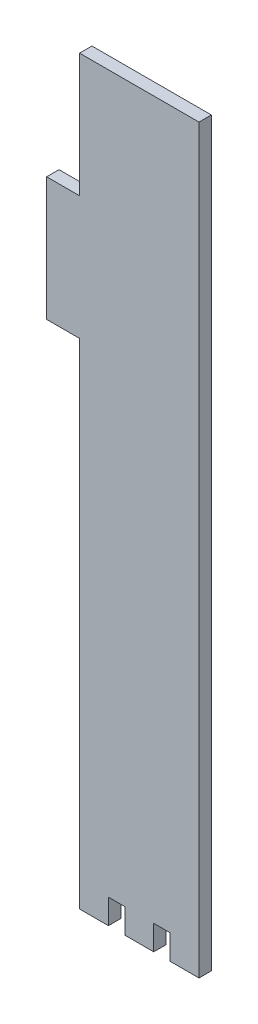
from build123d import *

# Parameters (mm, degrees)
BOSS_EXTRU_1_DEPTH = 3


with BuildPart() as part:
    # Esquisse1 → Boss.-Extru.1 (new body)
    with BuildSketch(Plane.XY):
        Polygon((-7, 0), (0, 0), (0, 180), (-29, 180), (-29, 150), (-37, 150), (-37, 120), (-29, 120), (-29, 0), (-22, 0), (-22, 6), (-18, 6), (-18, 0), (-11, 0), (-11, 6), (-7, 6), align=None)
    extrude(amount=BOSS_EXTRU_1_DEPTH)


solid = part.part
